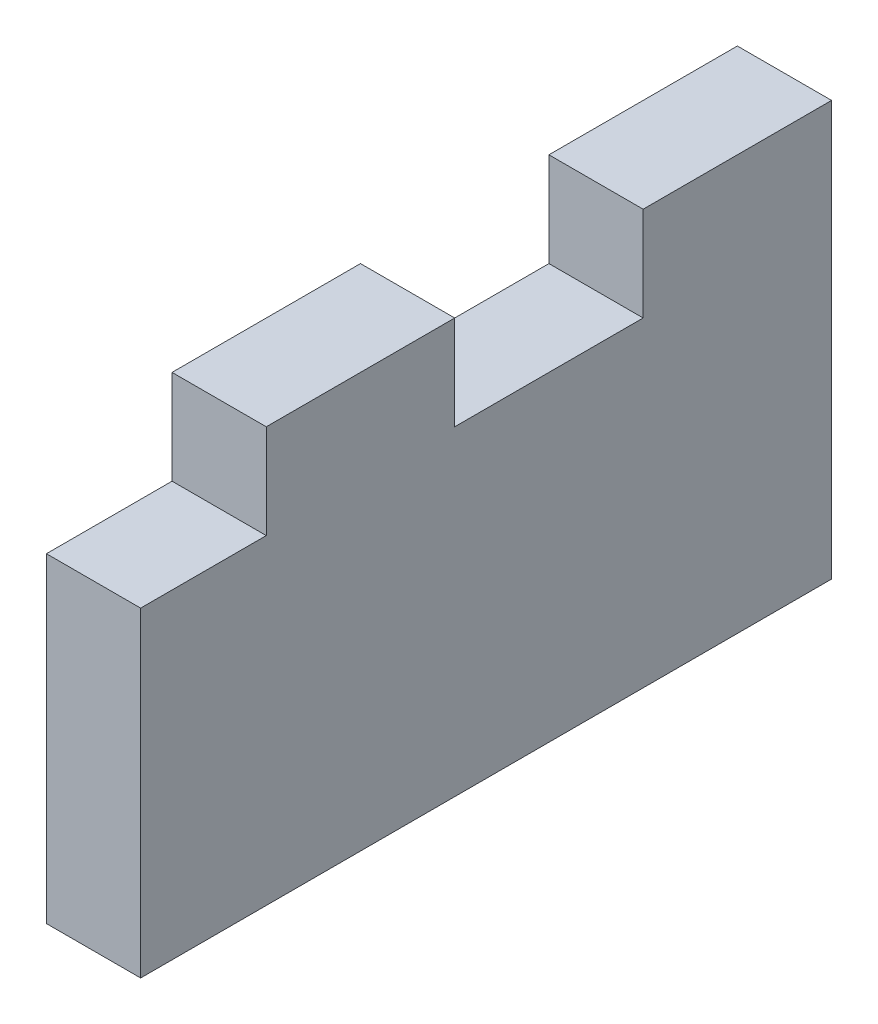
from build123d import *

# Parameters (mm, degrees)
BOSS_EXTRUDE1_DEPTH = 9.525


with BuildPart() as part:
    # Sketch2 → Boss-Extrude1 (new body)
    with BuildSketch(Plane(origin=(0, 0, 0), x_dir=(0, 0, -1), z_dir=(1, 0, 0))):
        Polygon((0, 32.385), (0, 0), (69.85, 0), (69.85, 41.91), (50.8, 41.91), (50.8, 32.385), (31.75, 32.385), (31.75, 41.91), (12.7, 41.91), (12.7, 32.385), align=None)
    extrude(amount=BOSS_EXTRUDE1_DEPTH)


solid = part.part
